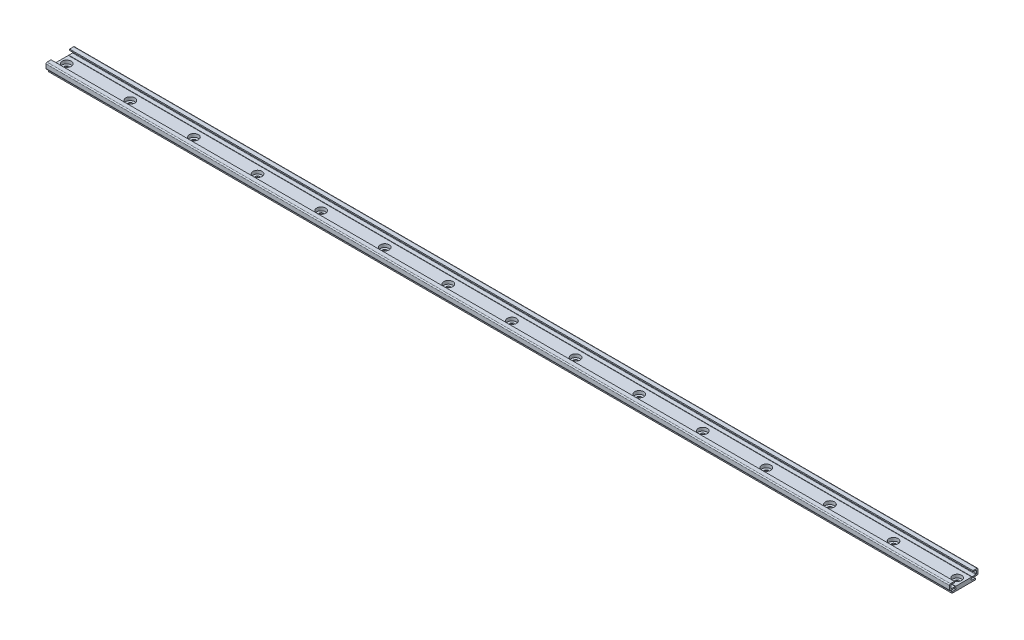
from build123d import *

# Parameters (mm, degrees)
BOSS_EXTRUDE1_DEPTH      = 500
BOSS_EXTRUDE1_DEPTH_BACK = 500
LPATTERN1_COUNT          = 17
LPATTERN1_PITCH          = 60
SKETCH6_W                = 123.7
SKETCH6_H                = 3.75
CUT_EXTRUDE1_DEPTH       = 501.257873501
SKETCH7_W                = 10.16
SKETCH7_H                = 57.415034805
CUT_EXTRUDE2_DEPTH       = 501.257873501
SKETCH8_W                = 13.97
SKETCH8_H                = 49.36174071
CUT_EXTRUDE3_DEPTH       = 501.257873501


with BuildPart() as part:
    # Sketch5 → Boss-Extrude1 (new, two sides: drawn at the far end of the back side and taken through both)
    with BuildSketch(Plane(origin=(0, 0, 0), x_dir=(0, 0, -1), z_dir=(1, 0, 0)).offset(-BOSS_EXTRUDE1_DEPTH_BACK)):
        with BuildLine():
            Line((8.75, 4.35), (8.75, 3.25))
            Line((8.75, 3.25), (11.5, 3.25))
            ThreePointArc((11.5, 3.25), (11.853553391, 3.103553391), (12, 2.75))
            Line((12, 2.75), (12, 0.25))
            ThreePointArc((12, 0.25), (11.853553391, -0.103553391), (11.5, -0.25))
            Line((11.5, -0.25), (7.95, -0.25))
            ThreePointArc((7.95, -0.25), (7.75, -0.45), (7.55, -0.25))
            Line((7.55, -0.25), (-7.55, -0.25))
            ThreePointArc((-7.55, -0.25), (-7.75, -0.45), (-7.95, -0.25))
            Line((-7.95, -0.25), (-11.5, -0.25))
            ThreePointArc((-11.5, -0.25), (-11.853553391, -0.103553391), (-12, 0.25))
            Line((-12, 0.25), (-12, 2.75))
            ThreePointArc((-12, 2.75), (-11.853553391, 3.103553391), (-11.5, 3.25))
            Line((-11.5, 3.25), (-8.75, 3.25))
            Line((-8.75, 3.25), (-8.75, 4.35))
            Line((-8.75, 4.35), (-12.5, 4.35))
            ThreePointArc((-12.5, 4.35), (-13.207106781, 4.057106781), (-13.5, 3.35))
            Line((-13.5, 3.35), (-13.5, -0.35))
            ThreePointArc((-13.5, -0.35), (-13.207106781, -1.057106781), (-12.5, -1.35))
            Line((-12.5, -1.35), (-7.8, -1.35))
            ThreePointArc((-7.8, -1.35), (-7.05, -2.1), (-7.8, -2.85))
            Line((-7.8, -2.85), (-10.8, -2.85))
            ThreePointArc((-10.8, -2.85), (-10.941421356, -2.908578644), (-11, -3.05))
            Line((-11, -3.05), (-11, -4.35))
            Line((-11, -4.35), (11, -4.35))
            Line((11, -4.35), (11, -3.05))
            ThreePointArc((11, -3.05), (10.941421356, -2.908578644), (10.8, -2.85))
            Line((10.8, -2.85), (7.8, -2.85))
            ThreePointArc((7.8, -2.85), (7.05, -2.1), (7.8, -1.35))
            Line((7.8, -1.35), (12.5, -1.35))
            ThreePointArc((12.5, -1.35), (13.207106781, -1.057106781), (13.5, -0.35))
            Line((13.5, -0.35), (13.5, 3.35))
            ThreePointArc((13.5, 3.35), (13.207106781, 4.057106781), (12.5, 4.35))
            Line((12.5, 4.35), (8.75, 4.35))
        make_face()
    extrude(amount=BOSS_EXTRUDE1_DEPTH + BOSS_EXTRUDE1_DEPTH_BACK)

    # Sketch3 → Cut-Revolve1 (revolve, cut)
    with BuildSketch(Plane.XY, mode=Mode.PRIVATE) as cut_revolve1_sk:
        Polygon((-484.25, 0), (-484.25, -3.35), (-482, -3.35), (-482, -4.35), (-480, -4.35), (-480, 0), align=None)
    cut_revolve1 = revolve(cut_revolve1_sk.sketch.rotate(Axis((-480, -4.35, 0), (0, 1, 0)), 270), axis=Axis((-480, -4.35, 0), (0, 1, 0)), mode=Mode.SUBTRACT)

    # LPattern1: Cut-Revolve1 ×17
    with Locations(*[(i * LPATTERN1_PITCH, 0, 0) for i in range(1, LPATTERN1_COUNT)]):
        add(cut_revolve1, mode=Mode.SUBTRACT)

    # Sketch6 → Cut-Extrude1 (cut, through all)
    with BuildSketch(Plane(origin=(0, 4.35, 0), x_dir=(1, 0, 0), z_dir=(0, 1, 0))):
        Polygon((376.3, 112.746397819), (376.3, 13.5), (376.3, 12.5), (500, 12.5), (500, 8.75), (376.3, 8.75), (376.3, -272.64081393), (559.245488979, -272.64081393), (559.245488979, 112.746397819), align=None)
        with Locations((438.15, 10.625)):
            Rectangle(SKETCH6_W, SKETCH6_H)
    extrude(amount=-CUT_EXTRUDE1_DEPTH, mode=Mode.SUBTRACT)

    # Sketch7 → Cut-Extrude2 (cut, through all)
    with BuildSketch(Plane(origin=(0, 4.35, 0), x_dir=(1, 0, 0), z_dir=(0, 1, 0))):
        with Locations((371.22, -15.207517403)):
            Rectangle(SKETCH7_W, SKETCH7_H)
    extrude(amount=-CUT_EXTRUDE2_DEPTH, mode=Mode.SUBTRACT)

    # Sketch8 → Cut-Extrude3 (cut, through all)
    with BuildSketch(Plane(origin=(0, 4.35, 0), x_dir=(1, 0, 0), z_dir=(0, 1, 0))):
        with Locations((-493.015, -11.180870355)):
            Rectangle(SKETCH8_W, SKETCH8_H)
    extrude(amount=-CUT_EXTRUDE3_DEPTH, mode=Mode.SUBTRACT)


solid = part.part
